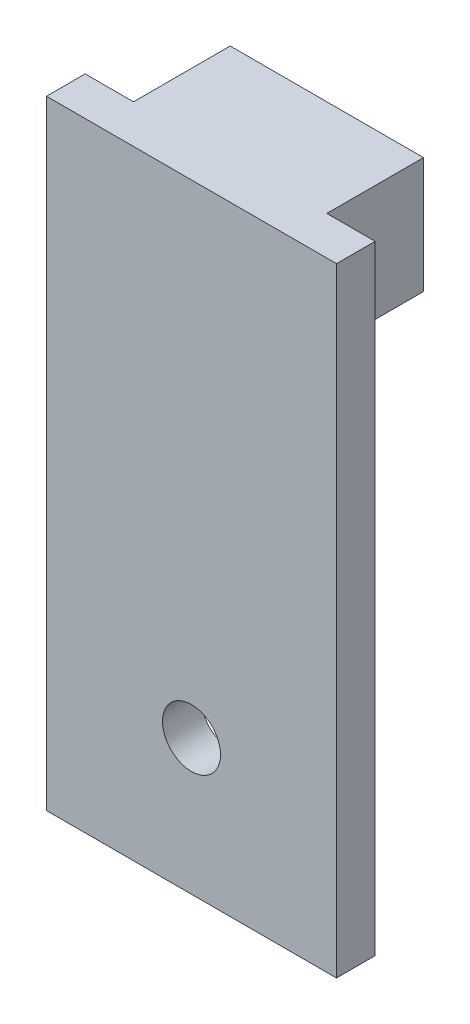
from build123d import *

# Parameters (mm, degrees)
SKETCH_1_W          = 15
SKETCH_1_H          = 32
EXTRUDE_1_DEPTH     = 2
SKETCH_2_W          = 10
SKETCH_2_H          = 6
EXTRUDE_2_DEPTH     = 6
CHAMFER_1_SIZE      = 1
SKETCH_3_R          = 1.5
CUT_EXTRUDE_1_DEPTH = 28


with BuildPart() as part:
    # 草图1 → 凸台-拉伸1 (new body)
    with BuildSketch(Plane.XY):
        Rectangle(SKETCH_1_W, SKETCH_1_H)
    extrude(amount=EXTRUDE_1_DEPTH)

    # 草图2 → 凸台-拉伸2 (add)
    with BuildSketch(Plane(origin=(0, 0, 0), x_dir=(-1, 0, 0), z_dir=(0, 0, -1))):
        with Locations((0, 13)):
            Rectangle(SKETCH_2_W, SKETCH_2_H)
    extrude(amount=EXTRUDE_2_DEPTH)

    # 倒角1
    chamfer_1_edges = [part.edges().sort_by_distance(p)[0] for p in [
        (0, 10, -6),
        (-5, 13, -6),
        (0, 16, -6),
        (5, 13, -6),
    ]]
    chamfer(chamfer_1_edges, length=CHAMFER_1_SIZE)

    # 草图3 → 切除-拉伸1 (cut)
    with BuildSketch(Plane.XY.offset(2)):
        with Locations((0, -9)):
            Circle(SKETCH_3_R)
    extrude(amount=-CUT_EXTRUDE_1_DEPTH, mode=Mode.SUBTRACT)


solid = part.part
